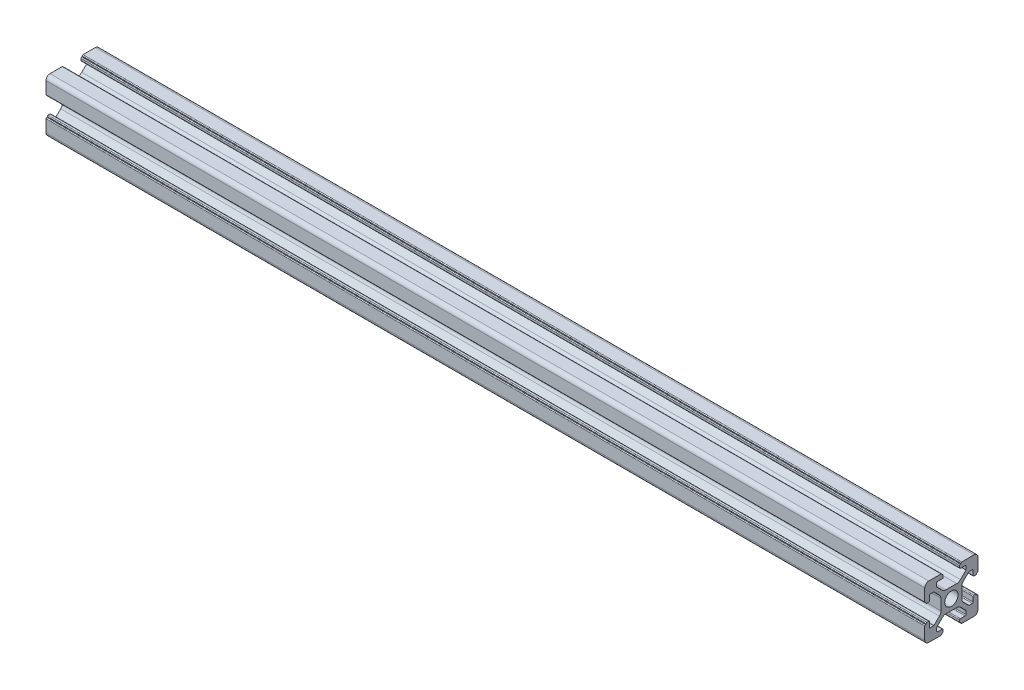
from build123d import *

# Parameters (mm, degrees)
SKETCH_1_R          = 2.5
MEMBER_2020_1_DEPTH = 330


with BuildPart() as part:
    # 草图1 → Member 2020_1 (new body)
    with BuildSketch(Plane.YZ.offset(-165)):
        with BuildLine():
            Line((3.9, 0), (3.9, -2.010912703))
            ThreePointArc((3.9, -2.010912703), (4.052240935, -2.776279568), (4.485786438, -3.425126266))
            Line((4.485786438, -3.425126266), (6.560660172, -5.5))
            Line((6.560660172, -5.5), (7.9, -5.5))
            ThreePointArc((7.9, -5.5), (8.112132034, -5.412132034), (8.2, -5.2))
            Line((8.2, -5.2), (8.2, -3.4))
            ThreePointArc((8.2, -3.4), (8.287867966, -3.187867966), (8.5, -3.1))
            Line((8.5, -3.1), (9.2, -3.1))
            ThreePointArc((9.2, -3.1), (9.412132034, -3.187867966), (9.5, -3.4))
            Line((9.5, -3.4), (9.5, -3.6))
            Line((9.5, -3.6), (9.7, -3.6))
            ThreePointArc((9.7, -3.6), (9.912132034, -3.687867966), (10, -3.9))
            Line((10, -3.9), (10, -8.5))
            ThreePointArc((10, -8.5), (9.560660172, -9.560660172), (8.5, -10))
            Line((8.5, -10), (3.9, -10))
            ThreePointArc((3.9, -10), (3.687867966, -9.912132034), (3.6, -9.7))
            ThreePointArc((3.6, -9.7), (3.541421356, -9.558578644), (3.4, -9.5))
            ThreePointArc((3.4, -9.5), (3.187867966, -9.412132034), (3.1, -9.2))
            Line((3.1, -9.2), (3.1, -8.5))
            ThreePointArc((3.1, -8.5), (3.187867966, -8.287867966), (3.4, -8.2))
            Line((3.4, -8.2), (5.2, -8.2))
            ThreePointArc((5.2, -8.2), (5.412132034, -8.112132034), (5.5, -7.9))
            Line((5.5, -7.9), (5.5, -6.68492424))
            ThreePointArc((5.5, -6.68492424), (5.47716386, -6.570119211), (5.412132034, -6.472792206))
            Line((5.412132034, -6.472792206), (3.425126266, -4.485786438))
            ThreePointArc((3.425126266, -4.485786438), (2.776279568, -4.052240935), (2.010912703, -3.9))
            Line((2.010912703, -3.9), (0, -3.9))
            Line((0, -3.9), (-2.010912703, -3.9))
            ThreePointArc((-2.010912703, -3.9), (-2.776279568, -4.052240935), (-3.425126266, -4.485786438))
            Line((-3.425126266, -4.485786438), (-5.412132034, -6.472792206))
            ThreePointArc((-5.412132034, -6.472792206), (-5.47716386, -6.570119211), (-5.5, -6.68492424))
            Line((-5.5, -6.68492424), (-5.5, -7.9))
            ThreePointArc((-5.5, -7.9), (-5.412132034, -8.112132034), (-5.2, -8.2))
            Line((-5.2, -8.2), (-3.4, -8.2))
            ThreePointArc((-3.4, -8.2), (-3.187867966, -8.287867966), (-3.1, -8.5))
            Line((-3.1, -8.5), (-3.1, -9.2))
            ThreePointArc((-3.1, -9.2), (-3.187867966, -9.412132034), (-3.4, -9.5))
            ThreePointArc((-3.4, -9.5), (-3.541421356, -9.558578644), (-3.6, -9.7))
            ThreePointArc((-3.6, -9.7), (-3.687867966, -9.912132034), (-3.9, -10))
            Line((-3.9, -10), (-8.5, -10))
            ThreePointArc((-8.5, -10), (-9.560660172, -9.560660172), (-10, -8.5))
            Line((-10, -8.5), (-10, -3.9))
            ThreePointArc((-10, -3.9), (-9.912132034, -3.687867966), (-9.7, -3.6))
            Line((-9.7, -3.6), (-9.5, -3.6))
            Line((-9.5, -3.6), (-9.5, -3.4))
            ThreePointArc((-9.5, -3.4), (-9.412132034, -3.187867966), (-9.2, -3.1))
            Line((-9.2, -3.1), (-8.5, -3.1))
            ThreePointArc((-8.5, -3.1), (-8.287867965, -3.187867966), (-8.2, -3.4))
            Line((-8.2, -3.4), (-8.2, -5.2))
            ThreePointArc((-8.2, -5.2), (-8.112132034, -5.412132034), (-7.9, -5.5))
            Line((-7.9, -5.5), (-6.68492424, -5.5))
            ThreePointArc((-6.68492424, -5.5), (-6.570119211, -5.47716386), (-6.472792206, -5.412132034))
            Line((-6.472792206, -5.412132034), (-4.485786438, -3.425126266))
            ThreePointArc((-4.485786438, -3.425126266), (-4.052240935, -2.776279568), (-3.9, -2.010912703))
            Line((-3.9, -2.010912703), (-3.9, 0))
            Line((-3.9, 0), (-3.9, 2.010912703))
            ThreePointArc((-3.9, 2.010912703), (-4.052240935, 2.776279568), (-4.485786438, 3.425126266))
            Line((-4.485786438, 3.425126266), (-6.472792206, 5.412132034))
            ThreePointArc((-6.472792206, 5.412132034), (-6.570119211, 5.47716386), (-6.68492424, 5.5))
            Line((-6.68492424, 5.5), (-7.9, 5.5))
            ThreePointArc((-7.9, 5.5), (-8.112132034, 5.412132034), (-8.2, 5.2))
            Line((-8.2, 5.2), (-8.2, 3.4))
            ThreePointArc((-8.2, 3.4), (-8.287867965, 3.187867966), (-8.5, 3.1))
            Line((-8.5, 3.1), (-9.2, 3.1))
            ThreePointArc((-9.2, 3.1), (-9.412132034, 3.187867966), (-9.5, 3.4))
            Line((-9.5, 3.4), (-9.5, 3.6))
            Line((-9.5, 3.6), (-9.7, 3.6))
            ThreePointArc((-9.7, 3.6), (-9.912132034, 3.687867966), (-10, 3.9))
            Line((-10, 3.9), (-10, 8.5))
            ThreePointArc((-10, 8.5), (-9.560660172, 9.560660172), (-8.5, 10))
            Line((-8.5, 10), (-3.9, 10))
            ThreePointArc((-3.9, 10), (-3.687867966, 9.912132034), (-3.6, 9.7))
            Line((-3.6, 9.7), (-3.6, 9.5))
            Line((-3.6, 9.5), (-3.4, 9.5))
            ThreePointArc((-3.4, 9.5), (-3.187867966, 9.412132034), (-3.1, 9.2))
            Line((-3.1, 9.2), (-3.1, 8.5))
            ThreePointArc((-3.1, 8.5), (-3.187867966, 8.287867966), (-3.4, 8.2))
            Line((-3.4, 8.2), (-5.2, 8.2))
            ThreePointArc((-5.2, 8.2), (-5.412132034, 8.112132034), (-5.5, 7.9))
            Line((-5.5, 7.9), (-5.5, 6.68492424))
            ThreePointArc((-5.5, 6.68492424), (-5.47716386, 6.570119211), (-5.412132034, 6.472792206))
            Line((-5.412132034, 6.472792206), (-3.425126266, 4.485786438))
            ThreePointArc((-3.425126266, 4.485786438), (-2.776279568, 4.052240935), (-2.010912703, 3.9))
            Line((-2.010912703, 3.9), (0, 3.9))
            Line((0, 3.9), (2.010912703, 3.9))
            ThreePointArc((2.010912703, 3.9), (2.776279568, 4.052240935), (3.425126266, 4.485786438))
            Line((3.425126266, 4.485786438), (5.412132034, 6.472792206))
            ThreePointArc((5.412132034, 6.472792206), (5.47716386, 6.570119211), (5.5, 6.68492424))
            Line((5.5, 6.68492424), (5.5, 7.9))
            ThreePointArc((5.5, 7.9), (5.412132034, 8.112132034), (5.2, 8.2))
            Line((5.2, 8.2), (3.4, 8.2))
            ThreePointArc((3.4, 8.2), (3.187867966, 8.287867966), (3.1, 8.5))
            Line((3.1, 8.5), (3.1, 9.2))
            ThreePointArc((3.1, 9.2), (3.187867966, 9.412132034), (3.4, 9.5))
            Line((3.4, 9.5), (3.6, 9.5))
            Line((3.6, 9.5), (3.6, 9.7))
            ThreePointArc((3.6, 9.7), (3.687867966, 9.912132034), (3.9, 10))
            Line((3.9, 10), (8.5, 10))
            ThreePointArc((8.5, 10), (9.560660172, 9.560660172), (10, 8.5))
            Line((10, 8.5), (10, 3.9))
            ThreePointArc((10, 3.9), (9.912132034, 3.687867966), (9.7, 3.6))
            Line((9.7, 3.6), (9.5, 3.6))
            Line((9.5, 3.6), (9.5, 3.4))
            ThreePointArc((9.5, 3.4), (9.412132034, 3.187867966), (9.2, 3.1))
            Line((9.2, 3.1), (8.5, 3.1))
            ThreePointArc((8.5, 3.1), (8.287867966, 3.187867966), (8.2, 3.4))
            Line((8.2, 3.4), (8.2, 5.2))
            ThreePointArc((8.2, 5.2), (8.112132034, 5.412132034), (7.9, 5.5))
            Line((7.9, 5.5), (6.68492424, 5.5))
            ThreePointArc((6.68492424, 5.5), (6.570119211, 5.47716386), (6.472792206, 5.412132034))
            Line((6.472792206, 5.412132034), (4.485786438, 3.425126266))
            ThreePointArc((4.485786438, 3.425126266), (4.052240935, 2.776279568), (3.9, 2.010912703))
            Line((3.9, 2.010912703), (3.9, 0))
        make_face()
        Circle(SKETCH_1_R, mode=Mode.SUBTRACT)
    extrude(amount=MEMBER_2020_1_DEPTH)


solid = part.part
